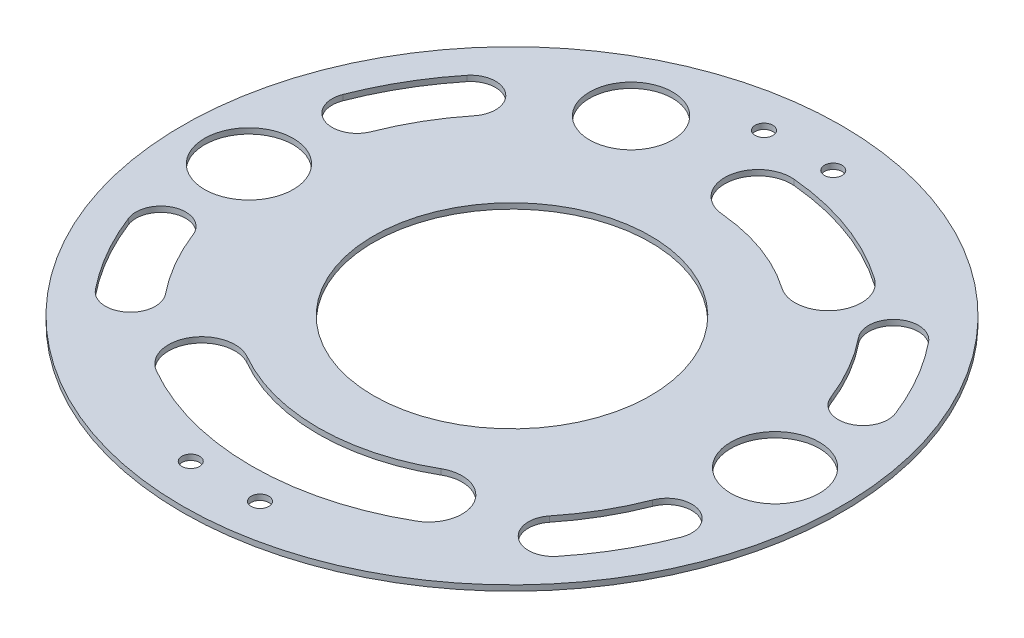
from build123d import *

# Parameters (mm, degrees)
SKETCH_1_R          = 59.5
SKETCH_1_R_2        = 25
SKETCH_1_R_3        = 1.6
EXTRUDE_1_DEPTH     = 1
SKETCH_2_R          = 8
SKETCH_2_R_2        = 7.5
CUT_EXTRUDE_1_DEPTH = 10


with BuildPart() as part:
    # 草图1 → 凸台-拉伸1 (new body)
    with BuildSketch(Plane(origin=(0, 0, 0), x_dir=(1, 0, 0), z_dir=(0, 1, 0))):
        with Locations(Location((0, 0, 0), (0, 0, 270))):
            Circle(SKETCH_1_R)
        with Locations(Location((0, 0, 0), (0, 0, 270))):
            Circle(SKETCH_1_R_2, mode=Mode.SUBTRACT)
        with Locations(Location((-6.25, 51.75, 0), (0, 0, 270))):
            Circle(SKETCH_1_R_3, mode=Mode.SUBTRACT)
        with Locations(Location((6.25, 51.75, 0), (0, 0, 270))):
            Circle(SKETCH_1_R_3, mode=Mode.SUBTRACT)
        with Locations(Location((6.25, -51.75, 0), (0, 0, 90))):
            Circle(SKETCH_1_R_3, mode=Mode.SUBTRACT)
        with Locations(Location((-6.25, -51.75, 0), (0, 0, 90))):
            Circle(SKETCH_1_R_3, mode=Mode.SUBTRACT)
        with BuildLine():
            ThreePointArc((49.880799132, 19.343109316), (46.332359102, 26.75), (41.692023621, 33.526484551))
            ThreePointArc((41.692023621, 33.526484551), (35.365233214, 34.213305594), (34.678412171, 27.886515187))
            ThreePointArc((34.678412171, 27.886515187), (38.538130468, 22.25), (41.489636661, 16.089128309))
            ThreePointArc((41.489636661, 16.089128309), (47.312208399, 13.520537577), (49.880799132, 19.343109316))
        make_face(mode=Mode.SUBTRACT)
        with BuildLine():
            ThreePointArc((41.692023621, -33.526484551), (46.332359102, -26.75), (49.880799132, -19.343109316))
            ThreePointArc((49.880799132, -19.343109316), (47.312208399, -13.520537577), (41.489636661, -16.089128309))
            ThreePointArc((41.489636661, -16.089128309), (38.538130468, -22.25), (34.678412171, -27.886515187))
            ThreePointArc((34.678412171, -27.886515187), (35.365233214, -34.213305594), (41.692023621, -33.526484551))
        make_face(mode=Mode.SUBTRACT)
        with BuildLine():
            ThreePointArc((-49.880799132, -19.343109316), (-46.332359102, -26.75), (-41.692023621, -33.526484551))
            ThreePointArc((-41.692023621, -33.526484551), (-35.365233214, -34.213305594), (-34.678412171, -27.886515187))
            ThreePointArc((-34.678412171, -27.886515187), (-38.538130468, -22.25), (-41.489636661, -16.089128309))
            ThreePointArc((-41.489636661, -16.089128309), (-47.312208399, -13.520537577), (-49.880799132, -19.343109316))
        make_face(mode=Mode.SUBTRACT)
        with BuildLine():
            ThreePointArc((-41.692023621, 33.526484551), (-46.332359102, 26.75), (-49.880799132, 19.343109316))
            ThreePointArc((-49.880799132, 19.343109316), (-47.312208399, 13.520537577), (-41.489636661, 16.089128309))
            ThreePointArc((-41.489636661, 16.089128309), (-38.538130468, 22.25), (-34.678412171, 27.886515187))
            ThreePointArc((-34.678412171, 27.886515187), (-35.365233214, 34.213305594), (-41.692023621, 33.526484551))
        make_face(mode=Mode.SUBTRACT)
    extrude(amount=EXTRUDE_1_DEPTH)

    # 草图2 → 切除-拉伸1 (cut)
    with BuildSketch(Plane.XZ):
        with Locations(Location((47.5, 0, 0), (0, 0, 270))):
            Circle(SKETCH_2_R)
        with Locations(Location((-47.5, 0, 0), (0, 0, 270))):
            Circle(SKETCH_2_R)
        with Locations(Location((-20.5, -42, 0), (0, 0, 270))):
            Circle(SKETCH_2_R_2)
        with BuildLine():
            ThreePointArc((4.096319909, -46.82115081), (16.074946736, -44.165553177), (26.958092508, -38.500146082))
            ThreePointArc((26.958092508, -38.500146082), (28.431546156, -30.143775198), (20.075175272, -28.67032155))
            ThreePointArc((20.075175272, -28.67032155), (11.970705016, -32.889241728), (3.050450996, -34.866814433))
            ThreePointArc((3.050450996, -34.866814433), (-2.403782736, -41.366917078), (4.096319909, -46.82115081))
        make_face()
        with BuildLine():
            ThreePointArc((23.5, 40.703193978), (0, 47), (-23.5, 40.703193978))
            ThreePointArc((-23.5, 40.703193978), (-25.696152423, 32.507041555), (-17.5, 30.310889132))
            ThreePointArc((-17.5, 30.310889132), (0, 35), (17.5, 30.310889132))
            ThreePointArc((17.5, 30.310889132), (25.696152423, 32.507041555), (23.5, 40.703193978))
        make_face()
    extrude(amount=-CUT_EXTRUDE_1_DEPTH, mode=Mode.SUBTRACT)


solid = part.part
